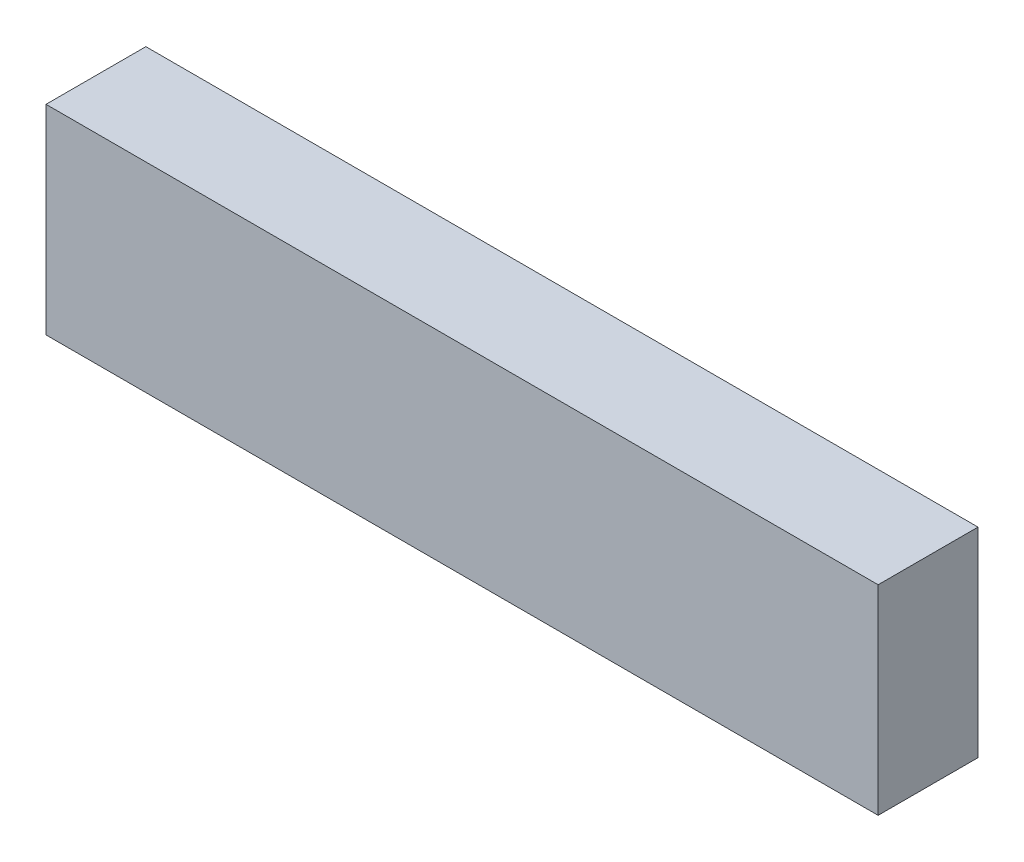
from build123d import *

# Parameters (mm, degrees)
ESBO_O1_W                = 125
ESBO_O1_H                = 30
RESSALTO_EXTRUS_O1_DEPTH = 15


with BuildPart() as part:
    # Esboço1 → Ressalto-extrusão1 (new body)
    with BuildSketch(Plane.XY):
        Rectangle(ESBO_O1_W, ESBO_O1_H)
    extrude(amount=RESSALTO_EXTRUS_O1_DEPTH)


solid = part.part
